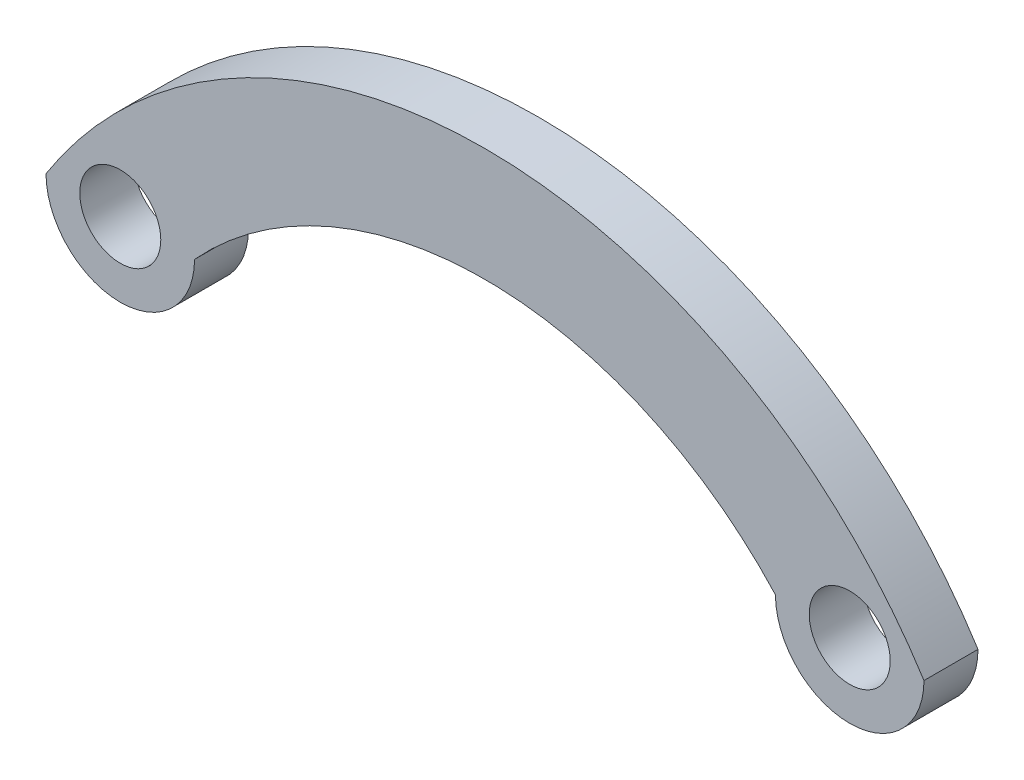
from build123d import *

# Parameters (mm, degrees)
SALIENTE_EXTRUIR1_DEPTH = 4
CROQUIS3_R              = 3
CORTAR_EXTRUIR2_DEPTH   = 4


with BuildPart() as part:
    # Croquis1 → Saliente-Extruir1 (new body)
    with BuildSketch(Plane.XY):
        with BuildLine():
            ThreePointArc((0, 0), (32.508460057, 17.865631211), (65.016920114, 0))
            ThreePointArc((65.016920114, 0), (59.516920114, -5.5), (54.016920114, 0))
            ThreePointArc((54.016920114, 0), (32.508460057, 9.471856419), (11, 0))
            ThreePointArc((11, 0), (5.5, -5.5), (0, 0))
        make_face()
    extrude(amount=SALIENTE_EXTRUIR1_DEPTH)

    # Croquis3 → Cortar-Extruir2 (cut)
    with BuildSketch(Plane.XY.offset(4)):
        with Locations((5.5, 0)):
            Circle(CROQUIS3_R)
        with Locations((59.516920114, 0)):
            Circle(CROQUIS3_R)
    extrude(amount=-CORTAR_EXTRUIR2_DEPTH, mode=Mode.SUBTRACT)


solid = part.part
